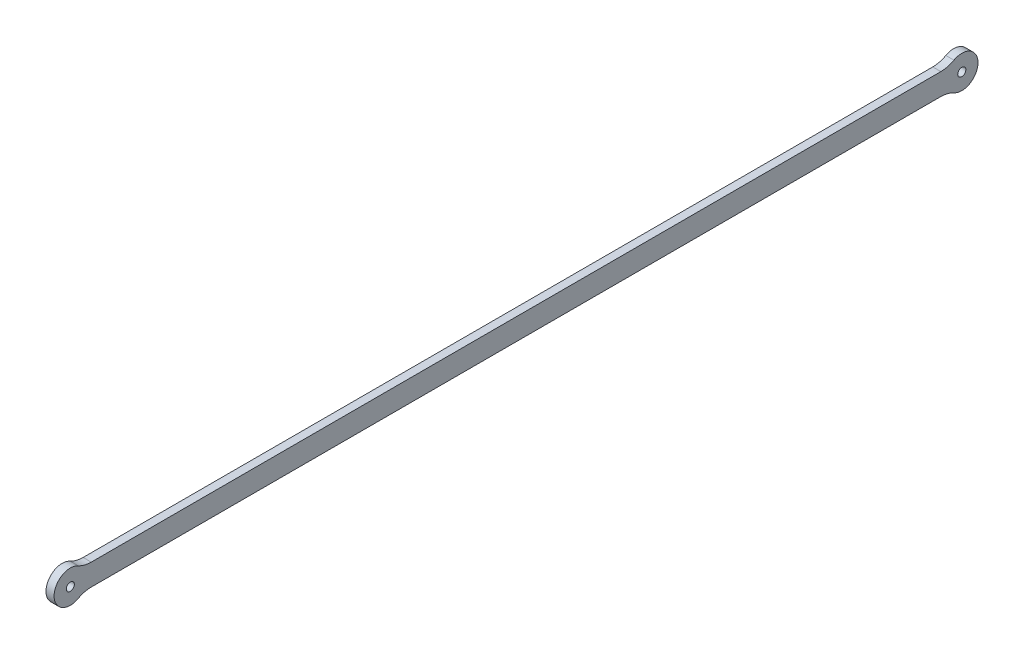
from build123d import *

# Parameters (mm, degrees)
SKETCH1_R           = 6
SKETCH1_R_2         = 1.5
SKETCH1_W           = 160.527864045
SKETCH1_H           = 8
BOSS_EXTRUDE1_DEPTH = 3
FILLET1_R           = 10
FILLET2_R           = 10
FILLET3_R           = 10
FILLET4_R           = 10


with BuildPart() as part:
    # Sketch1 → Boss-Extrude1 (new body)
    # profile 1 of 2: a face of its own
    with BuildSketch(Plane(origin=(0, 0, 0), x_dir=(0, 0, -1), z_dir=(1, 0, 0))):
        with Locations((165, 0)):
            Circle(SKETCH1_R)
        with Locations((165, 0)):
            Circle(SKETCH1_R_2, mode=Mode.SUBTRACT)
    # profile 2 of 2: a face of its own
    with BuildSketch(Plane(origin=(0, 0, 0), x_dir=(0, 0, -1), z_dir=(1, 0, 0))):
        with Locations((80.263932023, 0)):
            Rectangle(SKETCH1_W, SKETCH1_H)
    boss_extrude1 = extrude(amount=BOSS_EXTRUDE1_DEPTH)

    # Mirror1: Boss-Extrude1 across plane
    add(boss_extrude1.mirror(Plane.XY))

    # Fillet1
    fillet1_edges = [part.edges().sort_by_distance(p)[0] for p in [
        (1.5, 4, 160.527864045),
    ]]
    fillet(fillet1_edges, radius=FILLET1_R)

    # Fillet2
    fillet2_edges = [part.edges().sort_by_distance(p)[0] for p in [
        (1.5, -4, 160.527864045),
    ]]
    fillet(fillet2_edges, radius=FILLET2_R)

    # Fillet3
    fillet3_edges = [part.edges().sort_by_distance(p)[0] for p in [
        (1.5, -4, -160.527864045),
    ]]
    fillet(fillet3_edges, radius=FILLET3_R)

    # Fillet4
    fillet4_edges = [part.edges().sort_by_distance(p)[0] for p in [
        (1.5, 4, -160.527864045),
    ]]
    fillet(fillet4_edges, radius=FILLET4_R)


solid = part.part
